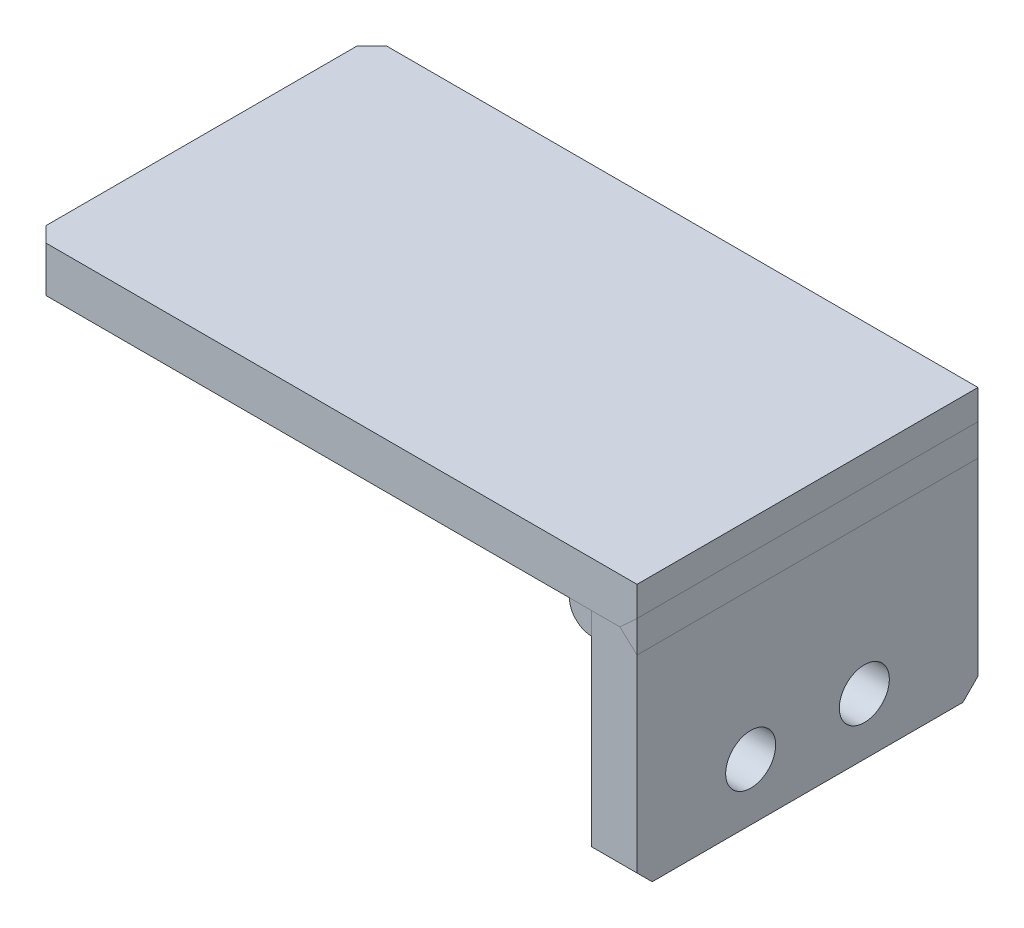
from build123d import *

# Parameters (mm, degrees)
SKETCH1_W             = 80
SKETCH1_H             = 45
BOSS_EXTRUDE1_DEPTH   = 6
CHAMFER1_SIZE         = 2
SKETCH2_W             = 6
SKETCH2_H             = 45
BOSS_EXTRUDE2_DEPTH   = 29
CUT_EXTRUDE1_DEPTH    = 99.234413522
BOSS_EXTRUDE3_DEPTH   = 45
BOSS_EXTRUDE3_2_DEPTH = 45
SKETCH6_R             = 3.3
CUT_EXTRUDE2_DEPTH    = 99.234413522
CHAMFER2_SIZE         = 2


with BuildPart() as part:
    # Sketch1 → Boss-Extrude1 (new body)
    with BuildSketch(Plane(origin=(0, 0, 0), x_dir=(1, 0, 0), z_dir=(0, 1, 0))):
        with Locations((40, 22.5)):
            Rectangle(SKETCH1_W, SKETCH1_H)
    extrude(amount=-BOSS_EXTRUDE1_DEPTH)

    # Chamfer1
    chamfer1_edges = [part.edges().sort_by_distance(p)[0] for p in [
        (0, -3, -45),
        (0, -3, 0),
    ]]
    chamfer(chamfer1_edges, length=CHAMFER1_SIZE)


with BuildPart() as body_2:
    # Sketch2 → Boss-Extrude2 (new body)
    with BuildSketch(Plane.XZ.offset(6)):
        with Locations((77, -22.5)):
            Rectangle(SKETCH2_W, SKETCH2_H)
    extrude(amount=BOSS_EXTRUDE2_DEPTH)


with BuildPart() as cut_extrude1_tool:
    # Sketch4 → Cut-Extrude1 (new, through all)
    with BuildSketch(Plane.XY):
        with BuildLine():
            Line((74, -8.919882898), (74, -6))
            Line((74, -6), (71.080117102, -6))
            ThreePointArc((71.080117102, -6), (71.935331002, -8.064668998), (74, -8.919882898))
        make_face()
        Polygon((80, -3.906286882), (80, -8.085180387), (77.73284395, -6), align=None)
    extrude(amount=-CUT_EXTRUDE1_DEPTH)


with BuildPart() as part_1:
    add(part.part)

    # Cut-Extrude1: cut by cut_extrude1_tool
    add(cut_extrude1_tool.part, mode=Mode.SUBTRACT)


with BuildPart() as body_2_1:
    add(body_2.part)

    # Cut-Extrude1: cut by cut_extrude1_tool
    add(cut_extrude1_tool.part, mode=Mode.SUBTRACT)

    # Sketch6 → Cut-Extrude2 (cut, through all)
    with BuildSketch(Plane(origin=(80, 0, 0), x_dir=(0, 0, -1), z_dir=(1, 0, 0))):
        with Locations((15, -27.5)):
            Circle(SKETCH6_R)
        with Locations((30, -27.5)):
            Circle(SKETCH6_R)
    extrude(amount=-CUT_EXTRUDE2_DEPTH, mode=Mode.SUBTRACT)

    # Chamfer2
    chamfer2_edges = [body_2_1.edges().sort_by_distance(p)[0] for p in [
        (77, -35, -45),
        (77, -35, 0),
    ]]
    chamfer(chamfer2_edges, length=CHAMFER2_SIZE)


with BuildPart() as body_3:
    # Sketch4<2> → Boss-Extrude3 (new, through all)
    with BuildSketch(Plane.XY):
        with BuildLine():
            Line((74, -8.919882898), (74, -6))
            Line((74, -6), (71.080117102, -6))
            ThreePointArc((71.080117102, -6), (71.935331002, -8.064668998), (74, -8.919882898))
        make_face()
    extrude(amount=-BOSS_EXTRUDE3_DEPTH)


with BuildPart() as body_4:
    # Sketch4<2> → Boss-Extrude3 2 (new, through all)
    with BuildSketch(Plane.XY):
        Polygon((80, -3.906286882), (80, -8.085180387), (77.73284395, -6), align=None)
    extrude(amount=-BOSS_EXTRUDE3_2_DEPTH)


solid = Compound([part_1.part, body_2_1.part, body_3.part, body_4.part])
